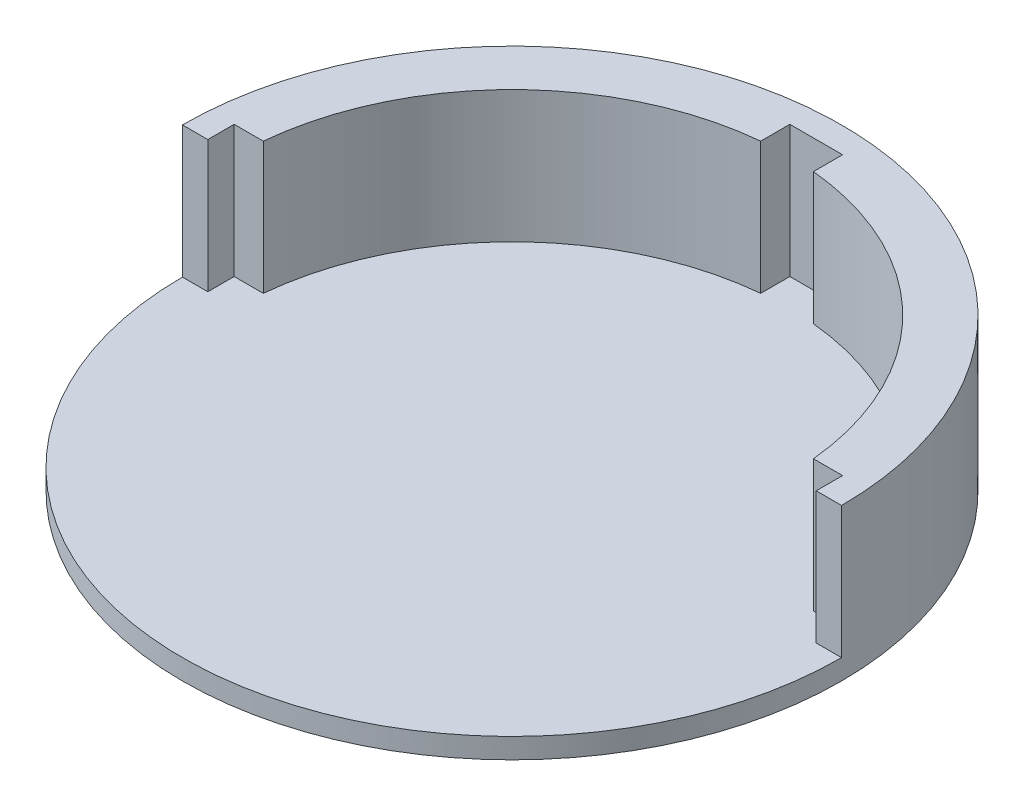
from build123d import *

# Parameters (mm, degrees)
SKETCH1_R           = 32.5
BOSS_EXTRUDE1_DEPTH = 2
SKETCH2_R           = 32.5
BOSS_EXTRUDE2_DEPTH = 13
SKETCH6_W           = 71.390071862
SKETCH6_H           = 35.774890597
CUT_EXTRUDE4_DEPTH  = 13


with BuildPart() as part:
    # Sketch1 → Boss-Extrude1 (new body)
    with BuildSketch(Plane(origin=(0, 0, 0), x_dir=(1, 0, 0), z_dir=(0, 1, 0))):
        with Locations(Location((0, 0, 0), (0, 0, 270))):
            Circle(SKETCH1_R)
    extrude(amount=BOSS_EXTRUDE1_DEPTH)

    # Sketch2 → Boss-Extrude2 (add)
    with BuildSketch(Plane(origin=(0, 2, 0), x_dir=(1, 0, 0), z_dir=(0, 1, 0))):
        with Locations(Location((0, 0, 0), (0, 0, 270))):
            Circle(SKETCH2_R)
        with BuildLine():
            Line((2.6, -27.125679715), (2.6, -30))
            Line((2.6, -30), (-2.6, -30))
            Line((-2.6, -30), (-2.6, -27.125679715))
            ThreePointArc((-2.6, -27.125679715), (-19.268659787, -19.268659787), (-27.125679715, -2.6))
            Line((-27.125679715, -2.6), (-30, -2.6))
            Line((-30, -2.6), (-30, 2.6))
            Line((-30, 2.6), (-27.125679715, 2.6))
            ThreePointArc((-27.125679715, 2.6), (-19.268659787, 19.268659787), (-2.6, 27.125679715))
            Line((-2.6, 27.125679715), (-2.6, 30))
            Line((-2.6, 30), (2.6, 30))
            Line((2.6, 30), (2.6, 27.125679715))
            ThreePointArc((2.6, 27.125679715), (19.268659787, 19.268659787), (27.125679715, 2.6))
            Line((27.125679715, 2.6), (30, 2.6))
            Line((30, 2.6), (30, -2.6))
            Line((30, -2.6), (27.125679715, -2.6))
            ThreePointArc((27.125679715, -2.6), (19.268659787, -19.268659787), (2.6, -27.125679715))
        make_face(mode=Mode.SUBTRACT)
    extrude(amount=BOSS_EXTRUDE2_DEPTH)

    # Sketch6 → Cut-Extrude4 (cut)
    with BuildSketch(Plane(origin=(0, 15, 0), x_dir=(1, 0, 0), z_dir=(0, 1, 0))):
        with Locations((0.159709333, -17.887445299)):
            Rectangle(SKETCH6_W, SKETCH6_H)
    extrude(amount=-CUT_EXTRUDE4_DEPTH, mode=Mode.SUBTRACT)


solid = part.part
